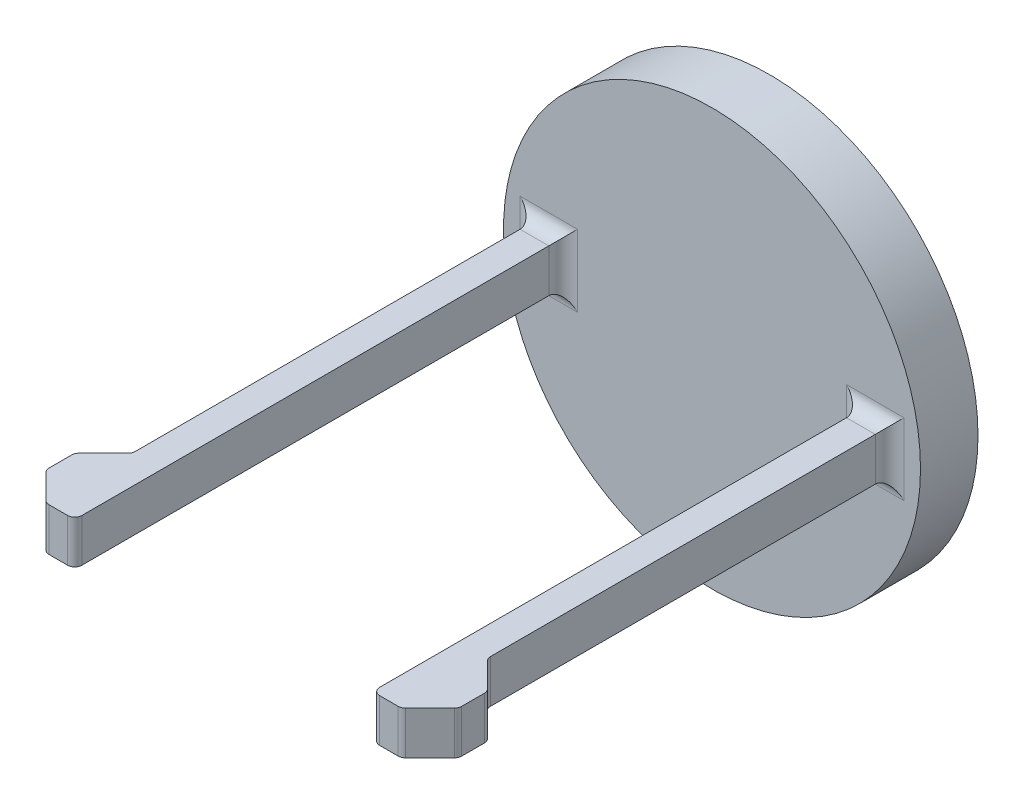
from build123d import *

# Parameters (mm, degrees)
SKETCH1_R           = 14.5
BOSS_EXTRUDE1_DEPTH = 4
SKETCH2_W           = 2
SKETCH2_H           = 3
BOSS_EXTRUDE2_DEPTH = 33.973847717
SKETCH3_W           = 3
SKETCH3_H           = 6
BOSS_EXTRUDE3_DEPTH = 2
CUT_EXTRUDE1_REACH  = 45.684
SKETCH5_W           = 3
SKETCH5_H           = 6
BOSS_EXTRUDE4_DEPTH = 2
CUT_EXTRUDE2_REACH  = 45.684
FILLET1_R           = 1
FILLET2_R           = 0.5


with BuildPart() as part:
    # Sketch1 → Boss-Extrude1 (new body)
    with BuildSketch(Plane(origin=(0, 0, 0), x_dir=(0, 1, 0), z_dir=(0, 0, 1))):
        with Locations(Location((0, 0, 0), (0, 0, 270))):
            Circle(SKETCH1_R)
    extrude(amount=BOSS_EXTRUDE1_DEPTH)

    # Sketch2 → Boss-Extrude2 (add)
    with BuildSketch(Plane.XY.offset(4)):
        with Locations((-11.353510083, 0)):
            Rectangle(SKETCH2_W, SKETCH2_H)
        with Locations((11.353510083, 0)):
            Rectangle(SKETCH2_W, SKETCH2_H)
    extrude(amount=BOSS_EXTRUDE2_DEPTH)

    # Sketch3 → Boss-Extrude3 (add)
    with BuildSketch(Plane(origin=(-12.353510083, 0, 0), x_dir=(0, -1, 0), z_dir=(-1, 0, 0))):
        with Locations((0, 34.973847717)):
            Rectangle(SKETCH3_W, SKETCH3_H)
    extrude(amount=BOSS_EXTRUDE3_DEPTH)

    # Sketch4 → Cut-Extrude1 (cut, up to next)
    with BuildSketch(Plane.XZ.offset(1.5), mode=Mode.PRIVATE) as cut_extrude1_sk1:
        Polygon((-12.353510083, 31.973847717), (-14.353510083, 33.973847717), (-14.353510083, 31.973847717), align=None)
    cut_extrude1_tool1 = extrude(cut_extrude1_sk1.sketch, amount=-CUT_EXTRUDE1_REACH, mode=Mode.PRIVATE) & part.part
    # Sketch4 → Cut-Extrude1 (cut, up to next)
    with BuildSketch(Plane.XZ.offset(1.5), mode=Mode.PRIVATE) as cut_extrude1_sk2:
        Polygon((-12.353510083, 37.973847717), (-14.353510083, 35.973847717), (-14.353510083, 37.973847717), align=None)
    cut_extrude1_tool2 = extrude(cut_extrude1_sk2.sketch, amount=-CUT_EXTRUDE1_REACH, mode=Mode.PRIVATE) & part.part
    add(cut_extrude1_tool1.solids().sort_by_distance((-13.686843, -1.5, 32.640514))[0], mode=Mode.SUBTRACT)
    add(cut_extrude1_tool2.solids().sort_by_distance((-13.686843, -1.5, 37.307181))[0], mode=Mode.SUBTRACT)

    # Sketch5 → Boss-Extrude4 (add)
    with BuildSketch(Plane.YZ.offset(12.353510083)):
        with Locations((0, 34.973847717)):
            Rectangle(SKETCH5_W, SKETCH5_H)
    extrude(amount=BOSS_EXTRUDE4_DEPTH)

    # Sketch6 → Cut-Extrude2 (cut, up to next)
    with BuildSketch(Plane.XZ.offset(1.5), mode=Mode.PRIVATE) as cut_extrude2_sk1:
        Polygon((12.353510083, 31.973847717), (14.353510083, 33.973847717), (14.353510083, 31.973847717), align=None)
    cut_extrude2_tool1 = extrude(cut_extrude2_sk1.sketch, amount=-CUT_EXTRUDE2_REACH, mode=Mode.PRIVATE) & part.part
    # Sketch6 → Cut-Extrude2 (cut, up to next)
    with BuildSketch(Plane.XZ.offset(1.5), mode=Mode.PRIVATE) as cut_extrude2_sk2:
        Polygon((12.353510083, 37.973847717), (14.353510083, 35.973847717), (14.353510083, 37.973847717), align=None)
    cut_extrude2_tool2 = extrude(cut_extrude2_sk2.sketch, amount=-CUT_EXTRUDE2_REACH, mode=Mode.PRIVATE) & part.part
    add(cut_extrude2_tool1.solids().sort_by_distance((13.686843, -1.5, 32.640514))[0], mode=Mode.SUBTRACT)
    add(cut_extrude2_tool2.solids().sort_by_distance((13.686843, -1.5, 37.307181))[0], mode=Mode.SUBTRACT)

    # Fillet1
    fillet1_edges = [part.edges().sort_by_distance(p)[0] for p in [
        (-12.353510083, 0, 4),
        (-11.353510083, -1.5, 4),
        (12.353510083, 0, 4),
        (11.353510083, 1.5, 4),
        (10.353510083, 0, 4),
        (11.353510083, -1.5, 4),
        (-10.353510083, 0, 4),
        (-11.353510083, 1.5, 4),
    ]]
    fillet(fillet1_edges, radius=FILLET1_R)

    # Fillet2
    fillet2_edges = [part.edges().sort_by_distance(p)[0] for p in [
        (-10.353510083, 0, 37.973847717),
        (10.353510083, 0, 37.973847717),
        (-12.353510083, 0, 31.973847717),
        (-14.353510083, 0, 33.973847717),
        (-12.353510083, 0, 37.973847717),
        (-14.353510083, 0, 35.973847717),
        (12.353510083, 0, 31.973847717),
        (14.353510083, 0, 33.973847717),
        (12.353510083, 0, 37.973847717),
        (14.353510083, 0, 35.973847717),
    ]]
    fillet(fillet2_edges, radius=FILLET2_R)


solid = part.part
